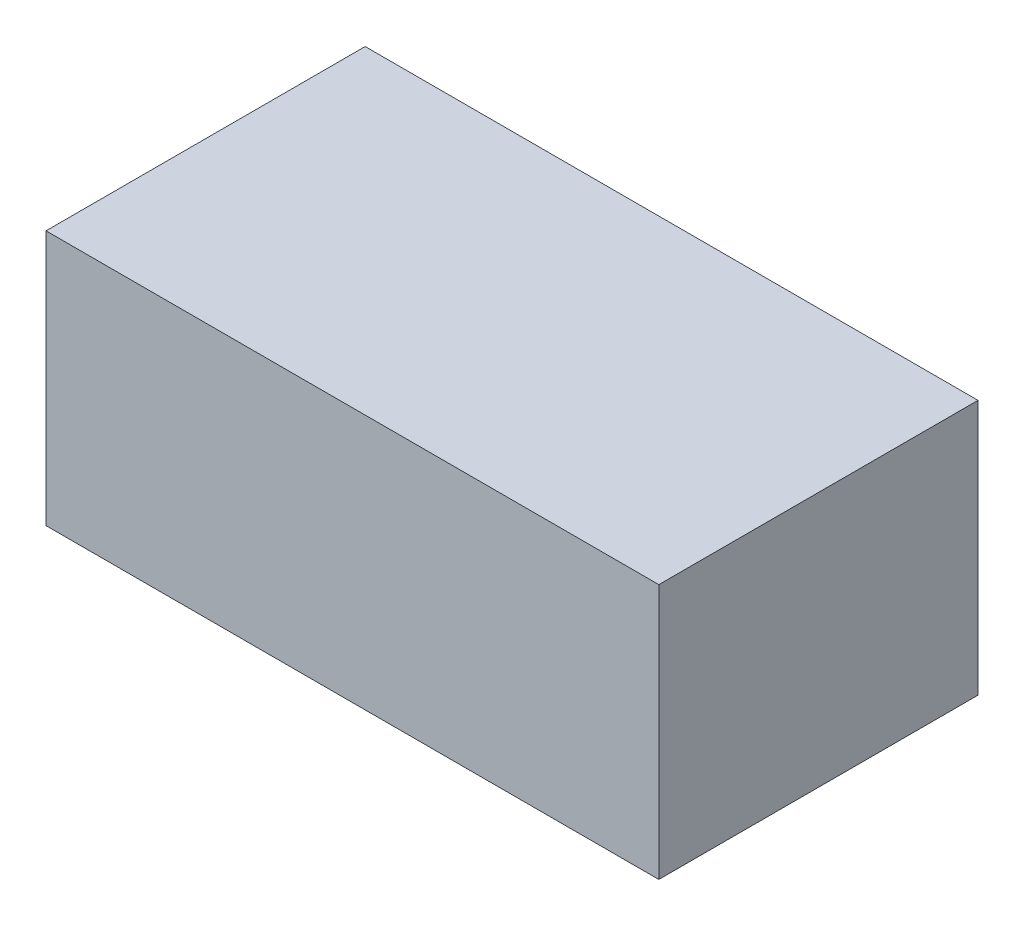
from build123d import *

# Parameters (mm, degrees)
SKETCH_2_W      = 48
SKETCH_2_H      = 25
EXTRUDE_1_DEPTH = 20


with BuildPart() as part:
    # 草图2 → 凸台-拉伸1 (new body)
    with BuildSketch(Plane(origin=(0, 0, 0), x_dir=(1, 0, 0), z_dir=(0, 1, 0))):
        Rectangle(SKETCH_2_W, SKETCH_2_H)
    extrude(amount=EXTRUDE_1_DEPTH)


solid = part.part
